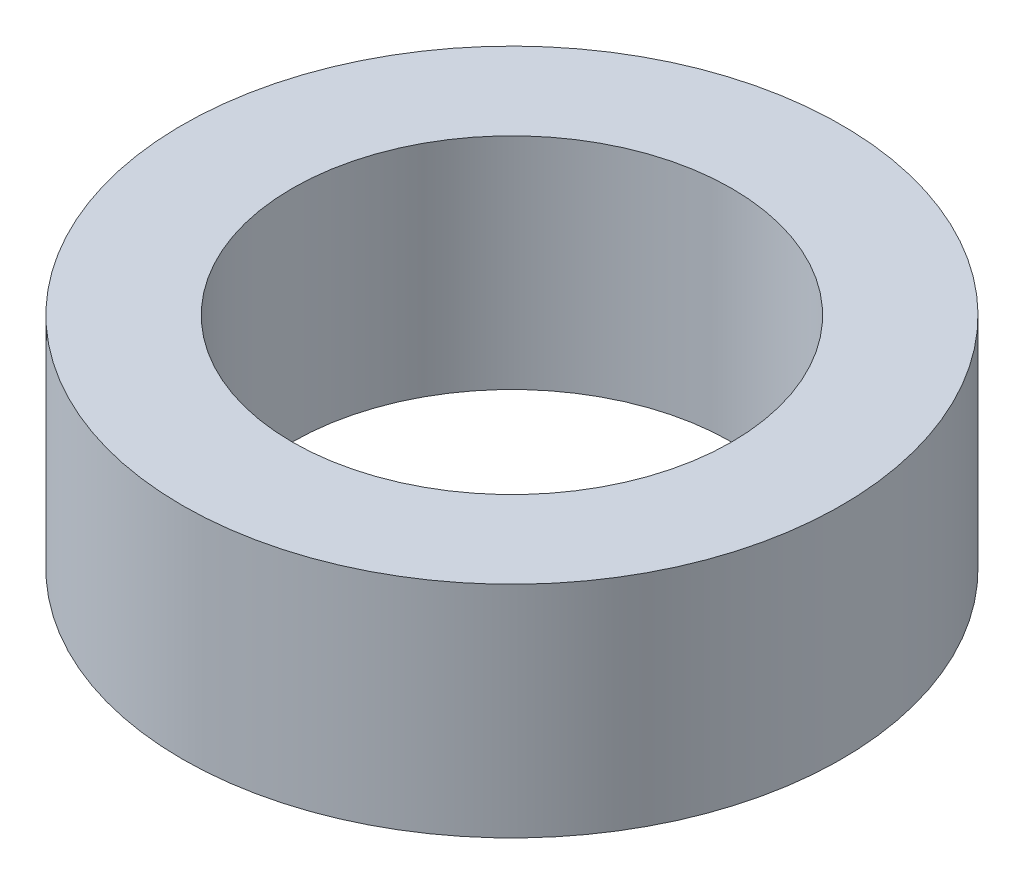
from build123d import *

# Parameters (mm, degrees)
SKETCH1_R           = 9
SKETCH1_R_2         = 6
BOSS_EXTRUDE1_DEPTH = 6


with BuildPart() as part:
    # Sketch1 → Boss-Extrude1 (new body)
    with BuildSketch(Plane(origin=(0, 0, 0), x_dir=(1, 0, 0), z_dir=(0, 1, 0))):
        with Locations(Location((0, 0, 0), (0, 0, 270))):
            Circle(SKETCH1_R)
        with Locations(Location((0, 0, 0), (0, 0, 270))):
            Circle(SKETCH1_R_2, mode=Mode.SUBTRACT)
    extrude(amount=BOSS_EXTRUDE1_DEPTH)


solid = part.part
